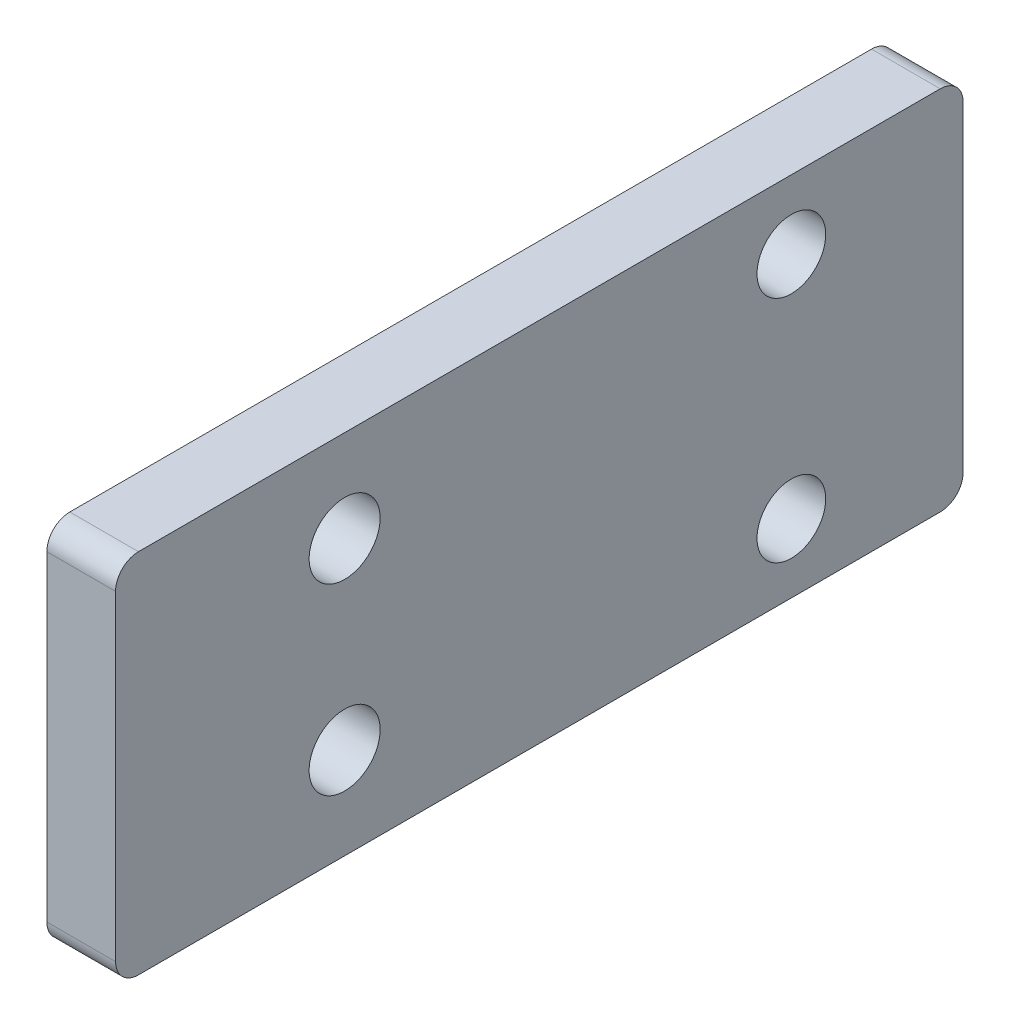
from build123d import *

# Parameters (mm, degrees)
SKETCH_1_W      = 37
SKETCH_1_H      = 16
SKETCH_1_R      = 1.5
SKETCH_1_R_2    = 1.55
EXTRUDE_1_DEPTH = 3
FILLET_1_R      = 1


with BuildPart() as part:
    # 草图1 → 凸台-拉伸1 (new body)
    with BuildSketch(Plane(origin=(0, 0, 0), x_dir=(0, 0, -1), z_dir=(1, 0, 0))):
        Rectangle(SKETCH_1_W, SKETCH_1_H)
        with Locations((11, 5)):
            Circle(SKETCH_1_R, mode=Mode.SUBTRACT)
        with Locations((11, -5)):
            Circle(SKETCH_1_R, mode=Mode.SUBTRACT)
        with Locations((-8.5, 4)):
            Circle(SKETCH_1_R_2, mode=Mode.SUBTRACT)
        with Locations((-8.5, -4)):
            Circle(SKETCH_1_R_2, mode=Mode.SUBTRACT)
    extrude(amount=EXTRUDE_1_DEPTH)

    # 圆角1
    fillet_1_edges = [part.edges().sort_by_distance(p)[0] for p in [
        (1.5, 8, 18.5),
        (1.5, 8, -18.5),
        (1.5, -8, -18.5),
        (1.5, -8, 18.5),
    ]]
    fillet(fillet_1_edges, radius=FILLET_1_R)


solid = part.part
